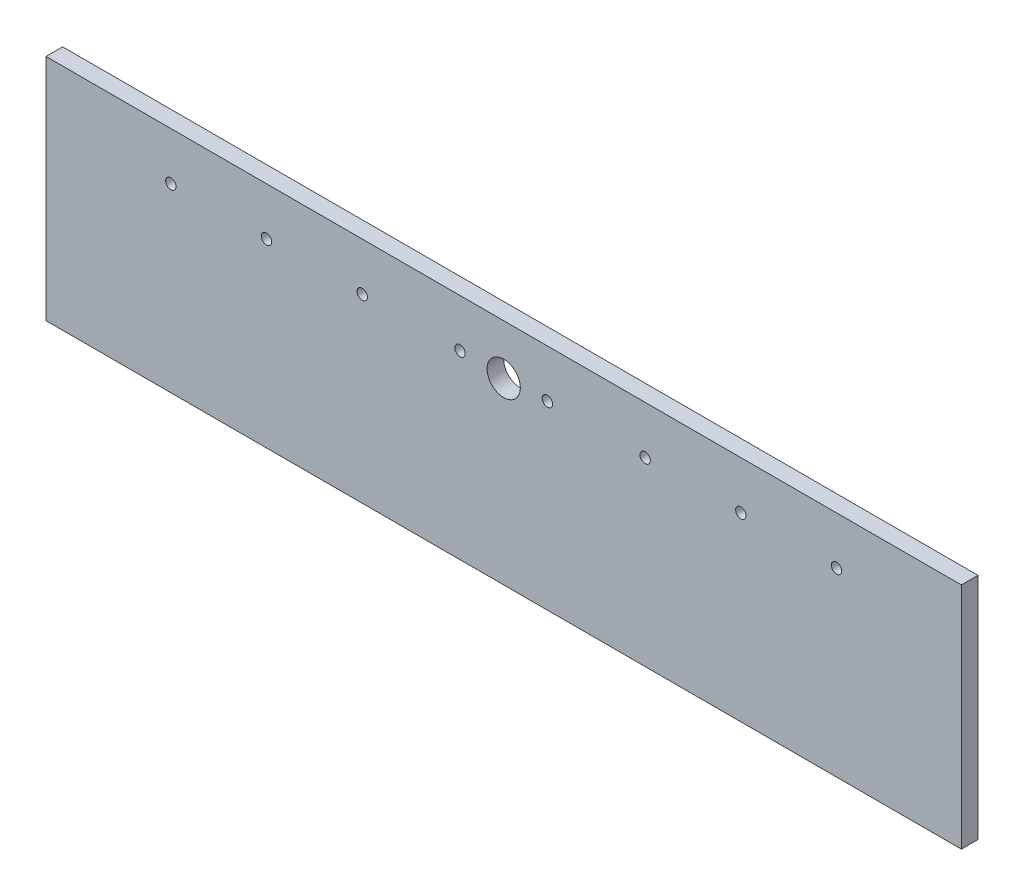
from build123d import *

# Parameters (mm, degrees)
SKETCH1_W           = 1397
SKETCH1_H           = 349.25
SKETCH1_R           = 25.4
SKETCH1_R_2         = 7.9375
BOSS_EXTRUDE1_DEPTH = 25.4


with BuildPart() as part:
    # Sketch1 → Boss-Extrude1 (new body)
    with BuildSketch(Plane.XY):
        with Locations((698.5, 174.625)):
            Rectangle(SKETCH1_W, SKETCH1_H)
        with Locations((698.5, 273.05)):
            Circle(SKETCH1_R, mode=Mode.SUBTRACT)
        with Locations((190.5, 276.225)):
            Circle(SKETCH1_R_2, mode=Mode.SUBTRACT)
        with Locations((336.55, 276.225)):
            Circle(SKETCH1_R_2, mode=Mode.SUBTRACT)
        with Locations((482.6, 276.225)):
            Circle(SKETCH1_R_2, mode=Mode.SUBTRACT)
        with Locations((631.825, 276.225)):
            Circle(SKETCH1_R_2, mode=Mode.SUBTRACT)
        with Locations(Location((1206.5, 276.225, 0), (0, 0, 180))):
            Circle(SKETCH1_R_2, mode=Mode.SUBTRACT)
        with Locations(Location((1060.45, 276.225, 0), (0, 0, 180))):
            Circle(SKETCH1_R_2, mode=Mode.SUBTRACT)
        with Locations(Location((914.4, 276.225, 0), (0, 0, 180))):
            Circle(SKETCH1_R_2, mode=Mode.SUBTRACT)
        with Locations(Location((765.175, 276.225, 0), (0, 0, 180))):
            Circle(SKETCH1_R_2, mode=Mode.SUBTRACT)
    extrude(amount=BOSS_EXTRUDE1_DEPTH)


solid = part.part
